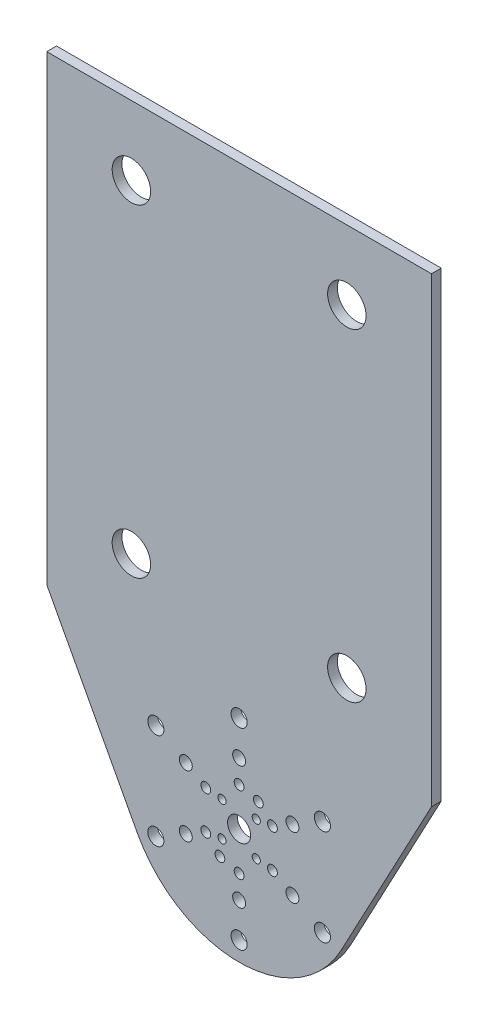
from build123d import *

# Parameters (mm, degrees)
BOSS_EXTRUDE1_DEPTH        = 6.35
SIA20_80MM_X_M8_X_6_D      = 8.4
IRB2400_50MM_X_M6_X_6_D    = 6.4
UR5_50MM_X_M6_X_4_D        = 6.4
R2000_125MM_X_M10_X_6_D    = 10.5
M5_CLEARANCE_HOLE1_D       = 5.3
F_25_0_25_DIAMETER_HOLE2_D = 25
F_15_0_15_DIAMETER_HOLE1_D = 15


with BuildPart() as part:
    # Sketch1 → Boss-Extrude1 (new body)
    with BuildSketch(Plane.XY):
        with BuildLine():
            Line((-125, 375), (125, 375))
            Line((125, 375), (125, 75))
            Line((125, 75), (66.176470588, -35.294117647))
            ThreePointArc((66.176470588, -35.294117647), (0, -75), (-66.176470588, -35.294117647))
            Line((-66.176470588, -35.294117647), (-125, 75))
            Line((-125, 75), (-125, 375))
        make_face()
    extrude(amount=BOSS_EXTRUDE1_DEPTH)

    # SIA20 (80mm x M8 x 6) (through all)
    with Locations(Plane.XY.offset(6.35)):
        with Locations((-34.641016151, 20), (-34.641016151, -20), (0, -40), (34.641016151, -20), (34.641016151, 20), (0, 40)):
            Hole(SIA20_80MM_X_M8_X_6_D / 2)

    # IRB2400 (50mm x M6 x 6) (through all)
    with Locations(Plane.XY.offset(6.35)):
        with Locations((0, 25), (21.650635095, -12.5), (21.650635095, 12.5), (-21.650635095, 12.5), (-21.650635095, -12.5), (0, -25)):
            Hole(IRB2400_50MM_X_M6_X_6_D / 2)

    # UR5 (50mm x M6 x 4) (through all)
    with Locations(Plane.XY.offset(6.35)):
        with Locations((12.5, 21.650635095), (-21.650635095, 12.5), (-12.5, -21.650635095), (21.650635095, -12.5)):
            Hole(UR5_50MM_X_M6_X_4_D / 2)

    # R2000 (125mm x M10 x 6) (through all)
    with Locations(Plane.XY.offset(6.35)):
        with Locations((-54.126587737, 31.25), (0, 62.5), (54.126587737, 31.25), (54.126587737, -31.25), (0, -62.5), (-54.126587737, -31.25)):
            Hole(R2000_125MM_X_M10_X_6_D / 2)

    # M5 Clearance Hole1 (through all)
    with Locations(Plane.XY.offset(6.35)):
        with Locations((-11.136931804, 11.136931804), (11.136931804, 11.136931804), (11.136931804, -11.136931804), (-11.136931804, -11.136931804)):
            Hole(M5_CLEARANCE_HOLE1_D / 2)

    # Ø25.0 (25) Diameter Hole2 (through all)
    with Locations(Plane.XY.offset(6.35)):
        with Locations((-70, 330), (-70, 120), (70, 120), (70, 330)):
            Hole(F_25_0_25_DIAMETER_HOLE2_D / 2)

    # Ø15.0 (15) Diameter Hole1 (through all)
    with Locations(Plane.XY.offset(6.35)):
        with Locations((0, 0)):
            Hole(F_15_0_15_DIAMETER_HOLE1_D / 2)


solid = part.part
